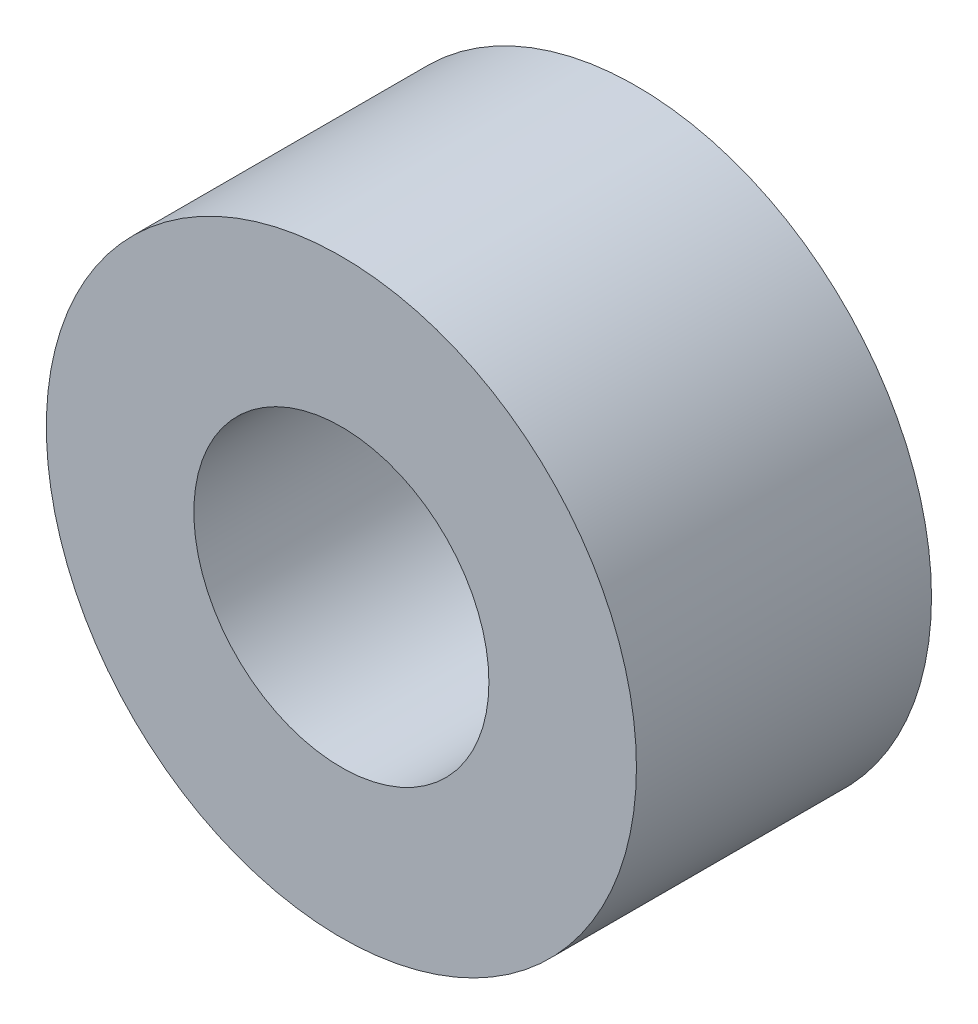
from build123d import *

# Parameters (mm, degrees)
SKETCH2_R           = 3
BOSS_EXTRUDE1_DEPTH = 3
SKETCH3_R           = 1.5
CUT_EXTRUDE1_DEPTH  = 6.196152423


with BuildPart() as part:
    # Sketch2 → Boss-Extrude1 (new body)
    with BuildSketch(Plane.XY):
        Circle(SKETCH2_R)
    extrude(amount=BOSS_EXTRUDE1_DEPTH)

    # Sketch3 → Cut-Extrude1 (cut, through all)
    with BuildSketch(Plane.XY.offset(3)):
        Circle(SKETCH3_R)
    extrude(amount=-CUT_EXTRUDE1_DEPTH, mode=Mode.SUBTRACT)


solid = part.part
